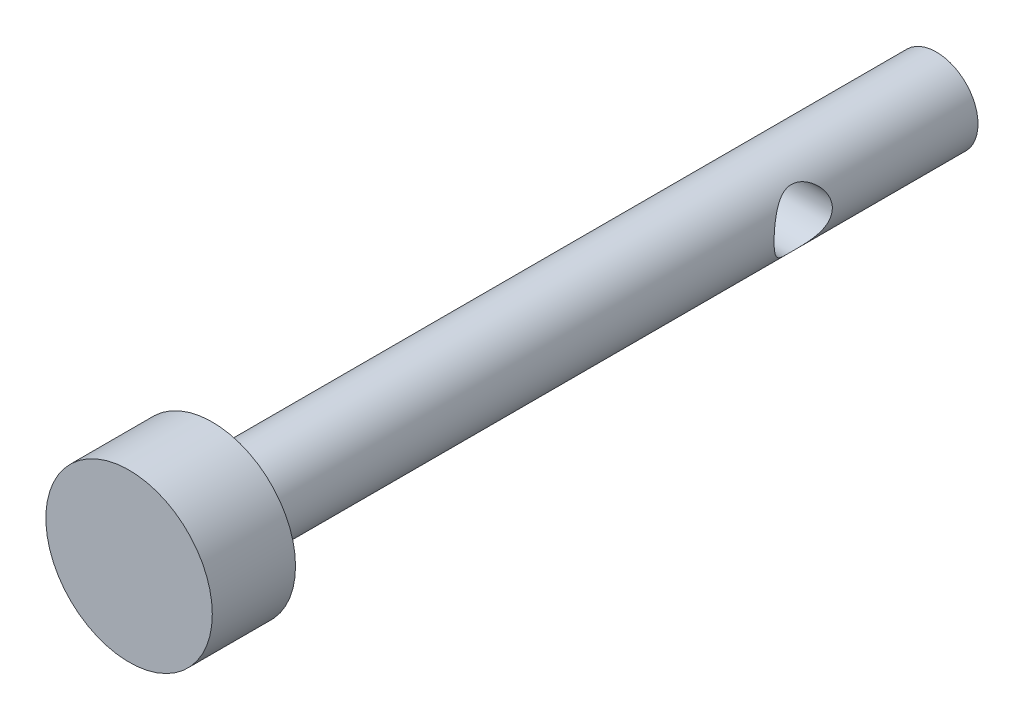
from build123d import *

# Parameters (mm, degrees)
SKETCH1_R           = 2.5
BOSS_EXTRUDE1_DEPTH = 43.5
SKETCH2_R           = 5
BOSS_EXTRUDE2_DEPTH = 5
CUT_EXTRUDE2_START  = 10
SKETCH3_R           = 1.75
CUT_EXTRUDE2_DEPTH  = 20


with BuildPart() as part:
    # Sketch1 → Boss-Extrude1 (new body)
    with BuildSketch(Plane.XY):
        Circle(SKETCH1_R)
    extrude(amount=BOSS_EXTRUDE1_DEPTH)

    # Sketch2 → Boss-Extrude2 (add)
    with BuildSketch(Plane.XY.offset(43.5)):
        Circle(SKETCH2_R)
    extrude(amount=BOSS_EXTRUDE2_DEPTH)

    # Sketch3 → Cut-Extrude2 (cut)
    with BuildSketch(Plane(origin=(0, 0, 0), x_dir=(0, 0, -1), z_dir=(1, 0, 0)).offset(CUT_EXTRUDE2_START)):
        with Locations(Location((-10.5, 0, 0), (0, 0, 180))):
            Circle(SKETCH3_R)
    extrude(amount=-CUT_EXTRUDE2_DEPTH, mode=Mode.SUBTRACT)


solid = part.part
